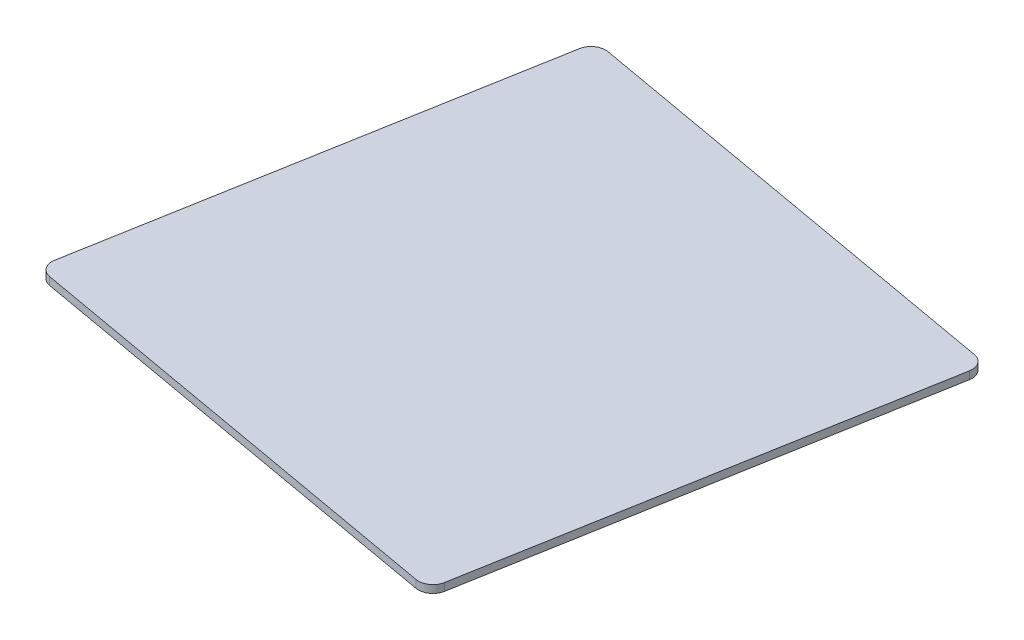
from build123d import *

# Parameters (mm, degrees)
BOSS_EXTRUDE1_DEPTH = 1.6


with BuildPart() as part:
    # Sketch1 → Boss-Extrude1 (new body)
    with BuildSketch(Plane(origin=(0, -27.771330334, 0), x_dir=(-1, 0, 0), z_dir=(0, -1, 0))):
        with BuildLine():
            Line((350.509937782, -192.890188286), (257.957917295, -209.32562268))
            ThreePointArc((257.957917295, -209.32562268), (256.022906635, -210.561669476), (255.528664547, -212.803945708))
            Line((255.528664547, -212.803945708), (271.96409894, -305.355966195))
            ThreePointArc((271.96409894, -305.355966195), (273.200145737, -307.290976855), (275.442421968, -307.785218943))
            Line((275.442421968, -307.785218943), (367.994442456, -291.34978455))
            ThreePointArc((367.994442456, -291.34978455), (369.929453116, -290.113737753), (370.423695204, -287.871461522))
            Line((370.423695204, -287.871461522), (353.98826081, -195.319441034))
            ThreePointArc((353.98826081, -195.319441034), (352.752214014, -193.384430374), (350.509937782, -192.890188286))
        make_face()
    extrude(amount=BOSS_EXTRUDE1_DEPTH)


solid = part.part
